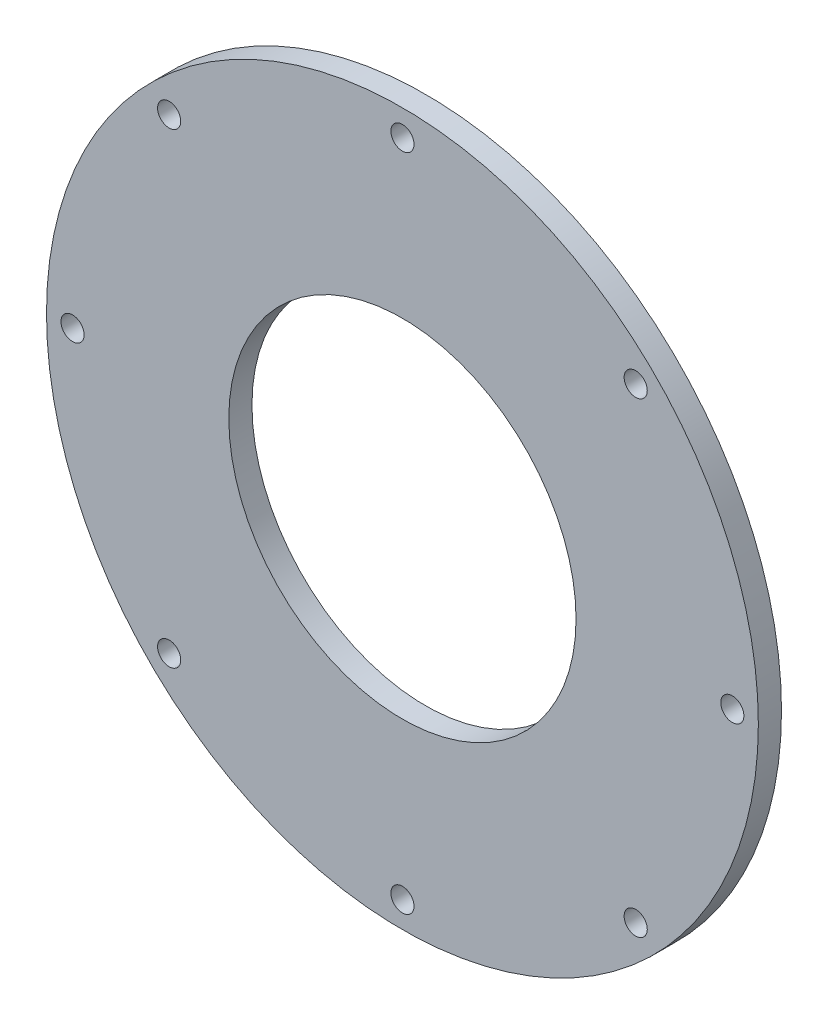
from build123d import *

# Parameters (mm, degrees)
SKETCH_1_R          = 61.5
SKETCH_1_R_2        = 2
SKETCH_1_R_3        = 2.6
SKETCH_1_R_4        = 15.5
EXTRUDE_1_DEPTH     = 4
SKETCH_2_R          = 30
CUT_EXTRUDE_1_DEPTH = 10


with BuildPart() as part:
    # 草图1 → 凸台-拉伸1 (new body)
    with BuildSketch(Plane.XY):
        Circle(SKETCH_1_R)
        with Locations((0, -57)):
            Circle(SKETCH_1_R_2, mode=Mode.SUBTRACT)
        with Locations((-40.305086528, -40.305086528)):
            Circle(SKETCH_1_R_2, mode=Mode.SUBTRACT)
        with Locations((-57, 0)):
            Circle(SKETCH_1_R_2, mode=Mode.SUBTRACT)
        with Locations((-40.305086528, 40.305086528)):
            Circle(SKETCH_1_R_2, mode=Mode.SUBTRACT)
        with Locations((0, -23.75)):
            Circle(SKETCH_1_R_3, mode=Mode.SUBTRACT)
        with Locations((-20.56810334, 11.875)):
            Circle(SKETCH_1_R_3, mode=Mode.SUBTRACT)
        with Locations((20.56810334, 11.875)):
            Circle(SKETCH_1_R_3, mode=Mode.SUBTRACT)
        with Locations((19.485571585, -11.25)):
            Circle(SKETCH_1_R_3, mode=Mode.SUBTRACT)
        with Locations((-19.485571585, -11.25)):
            Circle(SKETCH_1_R_3, mode=Mode.SUBTRACT)
        with Locations((0, 22.5)):
            Circle(SKETCH_1_R_3, mode=Mode.SUBTRACT)
        Circle(SKETCH_1_R_4, mode=Mode.SUBTRACT)
        with Locations((0, 57)):
            Circle(SKETCH_1_R_2, mode=Mode.SUBTRACT)
        with Locations((40.305086528, 40.305086528)):
            Circle(SKETCH_1_R_2, mode=Mode.SUBTRACT)
        with Locations((57, 0)):
            Circle(SKETCH_1_R_2, mode=Mode.SUBTRACT)
        with Locations((40.305086528, -40.305086528)):
            Circle(SKETCH_1_R_2, mode=Mode.SUBTRACT)
    extrude(amount=EXTRUDE_1_DEPTH)

    # 草图2 → 切除-拉伸1 (cut)
    with BuildSketch(Plane.XY.offset(4)):
        Circle(SKETCH_2_R)
    extrude(amount=-CUT_EXTRUDE_1_DEPTH, mode=Mode.SUBTRACT)


solid = part.part
